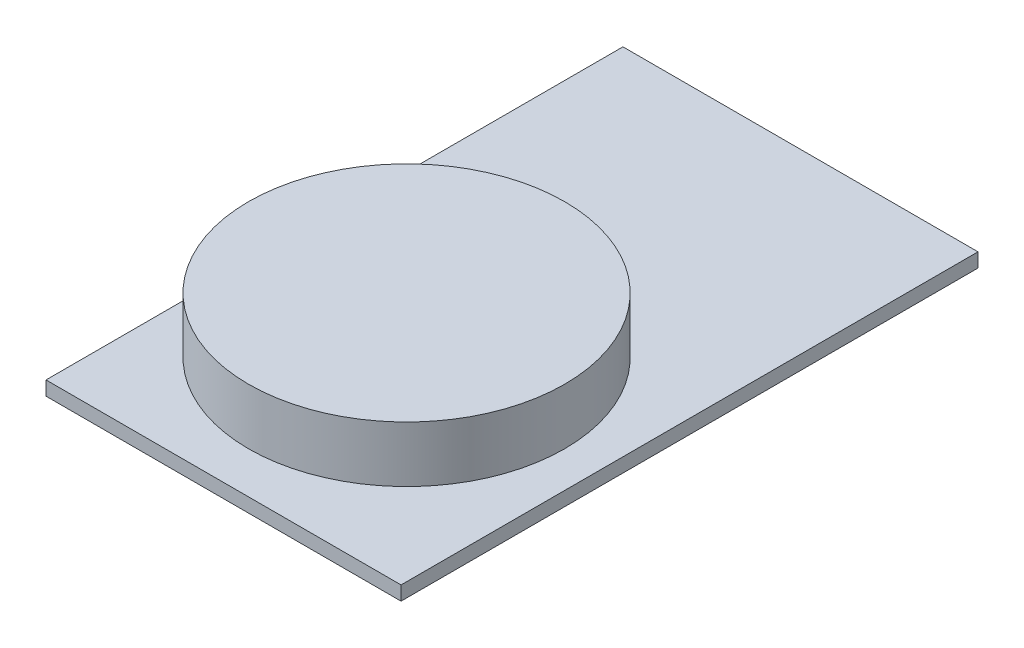
from build123d import *

# Parameters (mm, degrees)
SKETCH1_R           = 71.25
BOSS_EXTRUDE1_DEPTH = 12.6
SKETCH2_W           = 160
SKETCH2_H           = 260
BOSS_EXTRUDE2_DEPTH = 6.35


with BuildPart() as part:
    # Sketch1 → Boss-Extrude1 (new, symmetric)
    with BuildSketch(Plane(origin=(0, 0, 0), x_dir=(1, 0, 0), z_dir=(0, 1, 0))):
        with Locations(Location((0, 0, 0), (0, 0, 270))):
            Circle(SKETCH1_R)
    extrude(amount=BOSS_EXTRUDE1_DEPTH, both=True)

    # Sketch2 → Boss-Extrude2 (add)
    with BuildSketch(Plane.XZ.offset(12.6)):
        with Locations((7.5, -40)):
            Rectangle(SKETCH2_W, SKETCH2_H)
    extrude(amount=BOSS_EXTRUDE2_DEPTH)


solid = part.part
